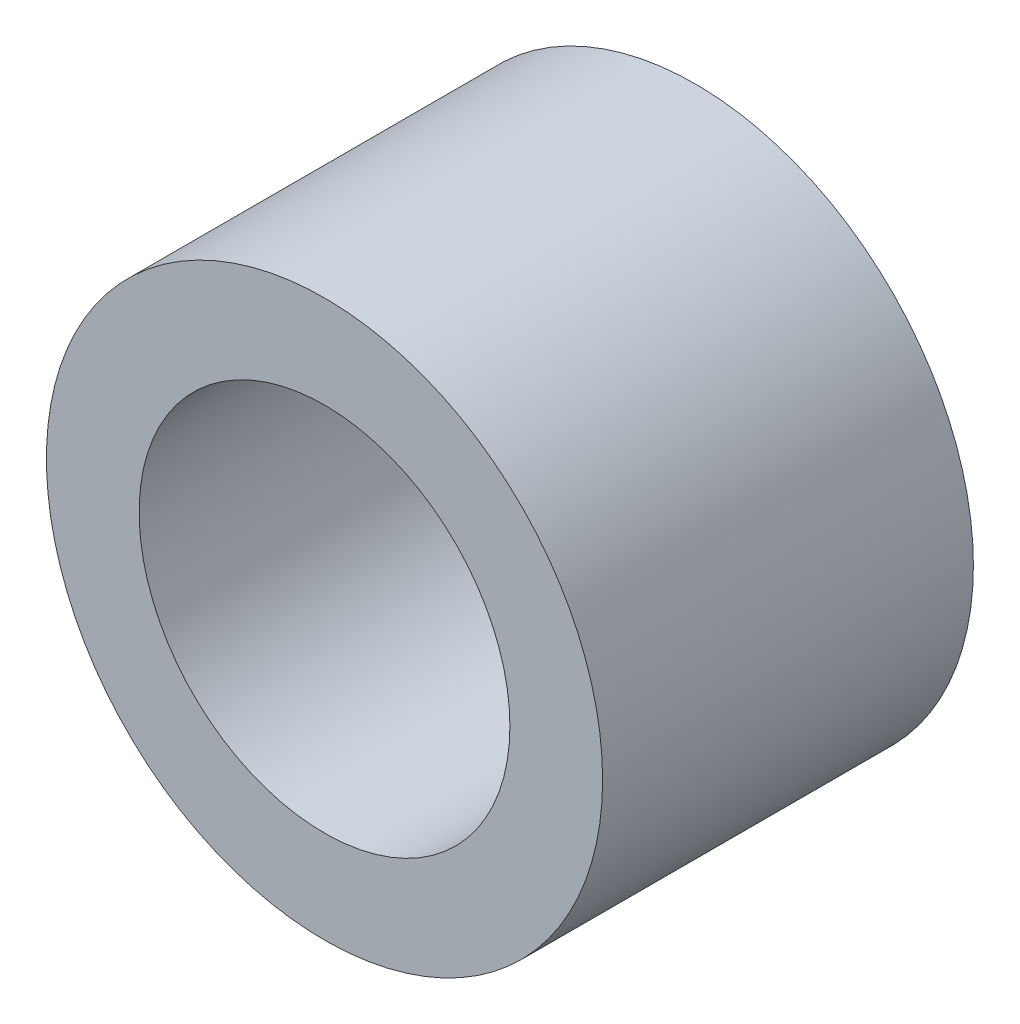
from build123d import *

# Parameters (mm, degrees)
SKETCH1_R           = 9.525
SKETCH1_R_2         = 6.35
BOSS_EXTRUDE1_DEPTH = 12.7


with BuildPart() as part:
    # Sketch1 → Boss-Extrude1 (new body)
    with BuildSketch(Plane.XY):
        Circle(SKETCH1_R)
        Circle(SKETCH1_R_2, mode=Mode.SUBTRACT)
    extrude(amount=BOSS_EXTRUDE1_DEPTH)


solid = part.part
